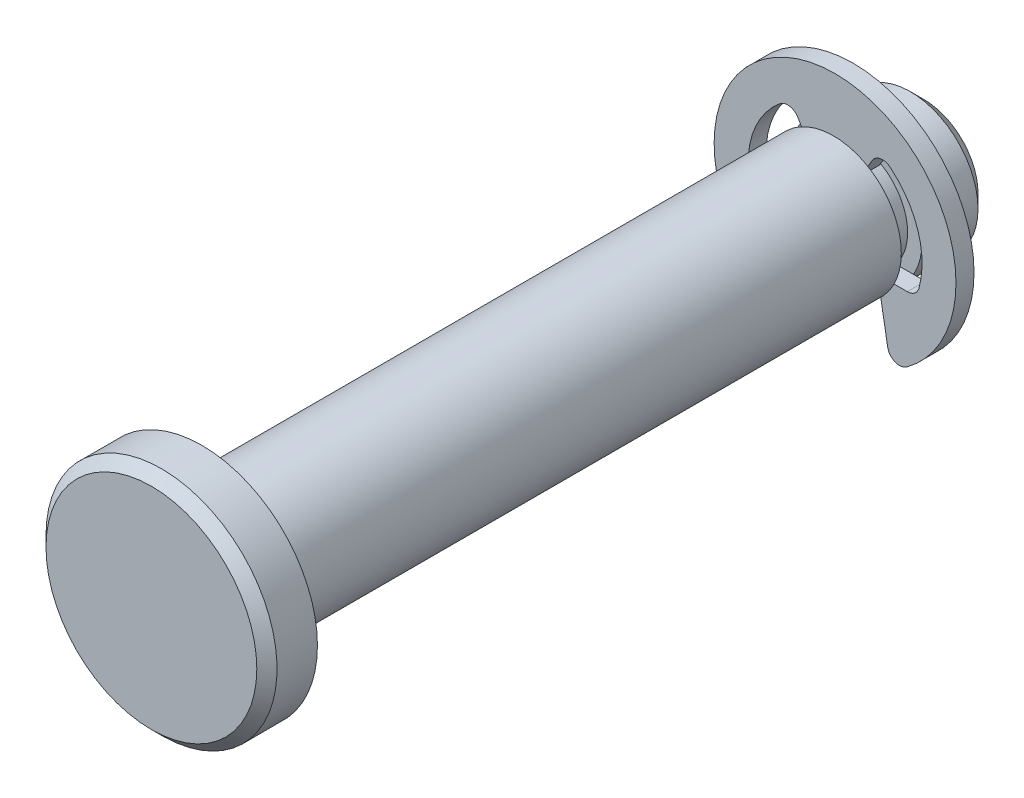
from build123d import *

# Parameters (mm, degrees)
SKETCH2_R      = 2.38125
EXTRUDE1_DEPTH = 12.7
SKETCH3_W      = 0.7366
SKETCH3_H      = 0.51435
SKETCH8_R      = 4.064
EXTRUDE6_DEPTH = 1.778
CHAMFER2_SIZE  = 0.3556
SKETCH4_R      = 4.2545
SKETCH4_R_2    = 1.8669
EXTRUDE2_DEPTH = 0.3175
EXTRUDE4_DEPTH = 16.678457338
EXTRUDE5_DEPTH = 0.635
FILLET1_R      = 0.42545
CHAMFER1_SIZE  = 0.47625


with BuildPart() as part:
    # Sketch2 → Extrude1 (new, symmetric)
    with BuildSketch(Plane.XY):
        Circle(SKETCH2_R)
    extrude(amount=EXTRUDE1_DEPTH, both=True)

    # Sketch3 → Cut-Revolve1 (revolve, cut)
    with BuildSketch(Plane(origin=(0, 0, 0), x_dir=(0, 0, -1), z_dir=(1, 0, 0)), mode=Mode.PRIVATE) as cut_revolve1_sk:
        with Locations((9.8933, 2.124075)):
            Rectangle(SKETCH3_W, SKETCH3_H)
    revolve(cut_revolve1_sk.sketch.rotate(Axis((0, 0, 12.7), (0, 0, -1)), 90), axis=Axis((0, 0, 12.7), (0, 0, -1)), mode=Mode.SUBTRACT)

    # Sketch8 → Extrude6 (add)
    with BuildSketch(Plane.XY.offset(12.7)):
        Circle(SKETCH8_R)
    extrude(amount=EXTRUDE6_DEPTH)

    # Chamfer2
    chamfer2_edges = [part.edges().sort_by_distance(p)[0] for p in [
        (-4.064, 0, 14.478),
    ]]
    chamfer(chamfer2_edges, length=CHAMFER2_SIZE)

    # Chamfer1
    chamfer1_edges = [part.edges().sort_by_distance(p)[0] for p in [
        (-2.38125, 0, -12.7),
    ]]
    chamfer(chamfer1_edges, length=CHAMFER1_SIZE)


with BuildPart() as body_2:
    # Sketch4 → Extrude2 (new, symmetric)
    with BuildSketch(Plane.XY.offset(-9.8933)):
        Circle(SKETCH4_R)
        Circle(SKETCH4_R_2, mode=Mode.SUBTRACT)
    extrude(amount=EXTRUDE2_DEPTH, both=True)

    # Sketch5 → Extrude4 (cut, through all)
    with BuildSketch(Plane.XY):
        with BuildLine():
            Line((-1.53035, 2.650643953), (0, 0))
            Line((0, 0), (1.53035, 2.650643953))
            ThreePointArc((1.53035, 2.650643953), (2.889287878, 1.00990101), (2.84836284, -1.12014))
            Line((2.84836284, -1.12014), (1.49352, -1.12014))
            Line((1.49352, -1.12014), (1.96168838, -3.775254819))
            ThreePointArc((1.96168838, -3.775254819), (0, -4.2545), (-1.96168838, -3.775254819))
            Line((-1.96168838, -3.775254819), (-1.49352, -1.12014))
            Line((-1.49352, -1.12014), (-2.84836284, -1.12014))
            ThreePointArc((-2.84836284, -1.12014), (-2.889287878, 1.00990101), (-1.53035, 2.650643953))
        make_face()
    extrude(amount=-EXTRUDE4_DEPTH, mode=Mode.SUBTRACT)

    # Sketch6 → Extrude5 (add)
    with BuildSketch(Plane.XY.offset(-9.5758)):
        with BuildLine():
            Line((-0.93345, 1.616782826), (0.93345, 1.616782826))
            ThreePointArc((0.93345, 1.616782826), (0, 1.8669), (-0.93345, 1.616782826))
        make_face()
    extrude(amount=-EXTRUDE5_DEPTH)

    # Fillet1
    fillet1_edges = [body_2.edges().sort_by_distance(p)[0] for p in [
        (1.53035, 2.650643953, -9.8933),
        (1.96168838, -3.775254819, -9.8933),
        (-2.84836284, -1.12014, -9.8933),
        (2.84836284, -1.12014, -9.8933),
        (-1.96168838, -3.775254819, -9.8933),
        (-1.53035, 2.650643953, -9.8933),
    ]]
    fillet(fillet1_edges, radius=FILLET1_R)


solid = Compound([part.part, body_2.part])
